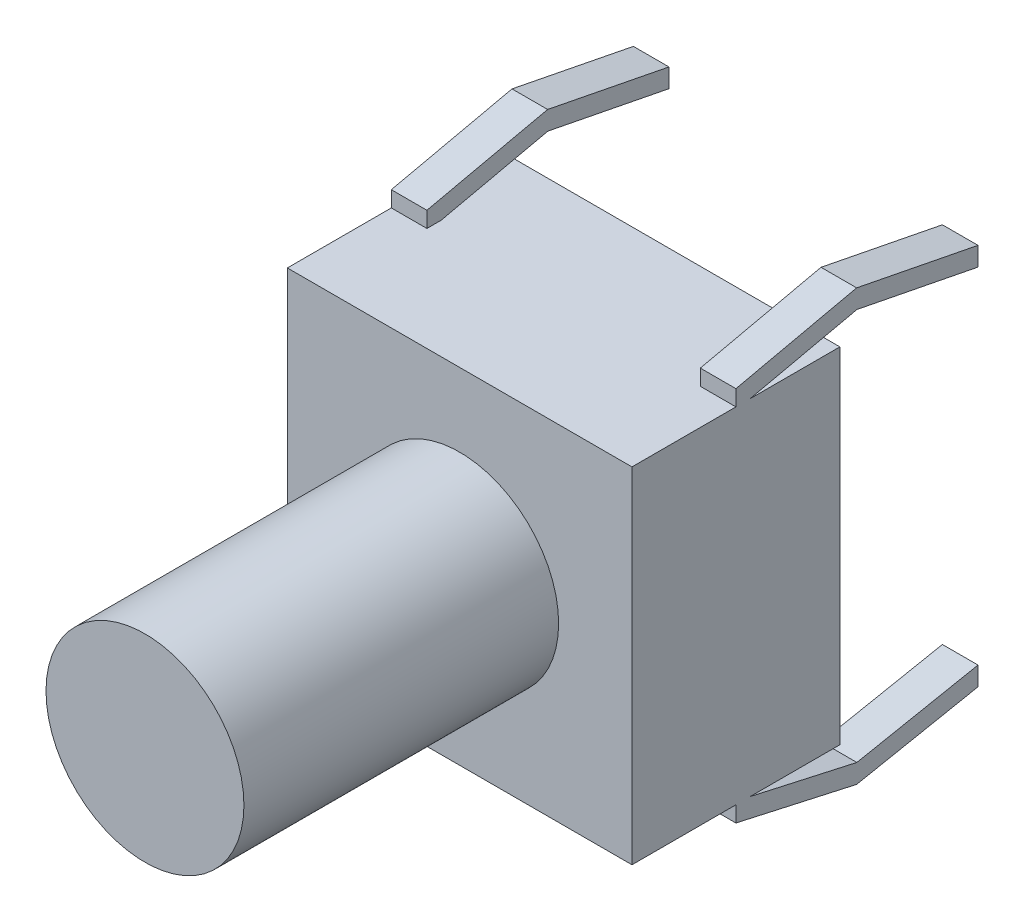
from build123d import *

# Parameters (mm, degrees)
SKETCH1_W            = 6.1468
SKETCH1_H            = 6.1468
BOSS_EXTRUDE1_DEPTH  = 3.7084
SKETCH2_R            = 1.7653
BOSS_EXTRUDE2_DEPTH  = 5.6134
BOSS_EXTRUDE3_DEPTH  = 0.635
MIRROR2_COPY_1_DEPTH = 0.635


with BuildPart() as part:
    # Sketch1 → Boss-Extrude1 (new body)
    with BuildSketch(Plane.XY):
        Rectangle(SKETCH1_W, SKETCH1_H)
    extrude(amount=BOSS_EXTRUDE1_DEPTH)

    # Sketch2 → Boss-Extrude2 (add)
    with BuildSketch(Plane.XY.offset(3.7084)):
        Circle(SKETCH2_R)
    extrude(amount=BOSS_EXTRUDE2_DEPTH)

    # Sketch3 → Boss-Extrude3 (add)
    with BuildSketch(Plane.ZY.offset(3.0734)):
        Polygon((1.8542, 3.0734), (1.8542, 3.355054083), (-0.299045368, 3.8354), (-2.4638, 3.409917683), (-2.4638, 3.0734), (-0.303331796, 3.49803982), (1.6002, 3.0734), align=None)
    boss_extrude3 = extrude(amount=-BOSS_EXTRUDE3_DEPTH)

    # Mirror1: Boss-Extrude3 across plane
    add(boss_extrude3.mirror(Plane.ZY))

    # Mirror2: Boss-Extrude3 across plane
    add(boss_extrude3.mirror(Plane.ZX))

    # Mirror2 copy 1 sketch → Mirror2 copy 1 (add)
    with BuildSketch(Plane(origin=(3.0734, 0, 0), x_dir=(0, 0, 1), z_dir=(1, 0, 0))):
        Polygon((1.8542, 3.0734), (1.8542, 3.355054083), (-0.299045368, 3.8354), (-2.4638, 3.409917683), (-2.4638, 3.0734), (-0.303331796, 3.49803982), (1.6002, 3.0734), align=None)
    extrude(amount=-MIRROR2_COPY_1_DEPTH)


solid = part.part
